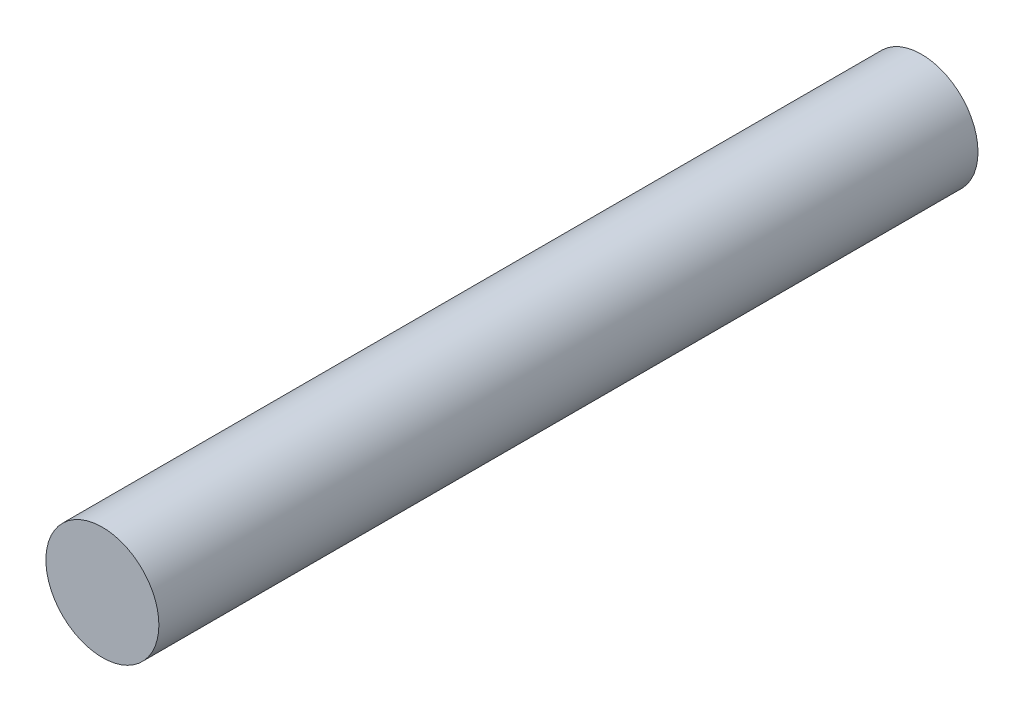
from build123d import *

# Parameters (mm, degrees)
SHAFT_ENVELOPE_START = -72.5
SKETCH_1_R           = 10
SHAFT_ENVELOPE_DEPTH = 145


with BuildPart() as part:
    # Эскиз1 → Shaft_envelope (new body)
    with BuildSketch(Plane.XY.offset(SHAFT_ENVELOPE_START)):
        Circle(SKETCH_1_R)
    extrude(amount=SHAFT_ENVELOPE_DEPTH)


solid = part.part
